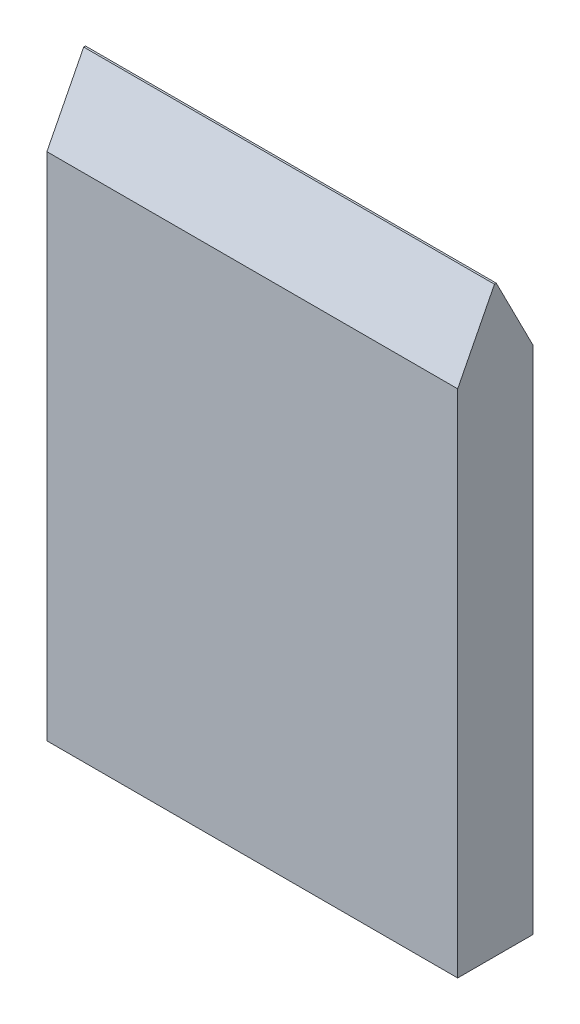
from build123d import *

# Parameters (mm, degrees)
SKETCH1_W           = 6.7
SKETCH1_H           = 9.5
BOSS_EXTRUDE1_DEPTH = 1.23
CHAMFER1_SIZE       = 0.6
CHAMFER1_SIZE2      = 1.177566303


with BuildPart() as part:
    # Sketch1 → Boss-Extrude1 (new body)
    with BuildSketch(Plane.XY):
        Rectangle(SKETCH1_W, SKETCH1_H)
    extrude(amount=BOSS_EXTRUDE1_DEPTH)

    # Chamfer1
    chamfer1_edges = [part.edges().sort_by_distance(p)[0] for p in [
        (0, 4.75, 1.23),
        (0, 4.75, 0),
    ]]
    chamfer1_side = [part.faces().sort_by_distance(p)[0] for p in [
        (0, 4.75, 0.615),
    ]]
    chamfer(chamfer1_edges, length=CHAMFER1_SIZE, length2=CHAMFER1_SIZE2, reference=chamfer1_side[0])


solid = part.part
